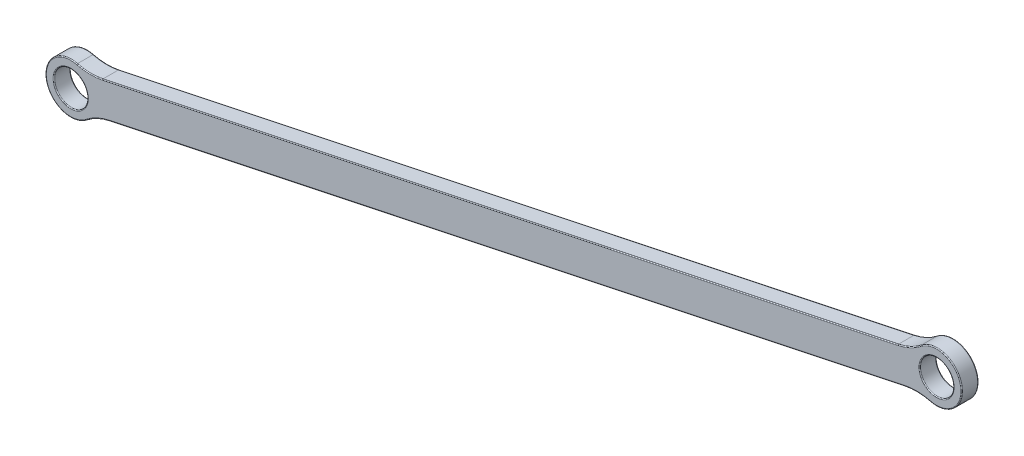
from build123d import *

# Parameters (mm, degrees)
BOSS_EXTRUDE1_DEPTH = 3
FILLET1_R           = 10
FILLET2_R           = 0.15


with BuildPart() as part:
    # Sketch1 → Boss-Extrude1 (new body)
    with BuildSketch(Plane.XY):
        with BuildLine():
            ThreePointArc((-209.835147147, 194.207413795), (-213.390440211, 196.522557684), (-211.075296322, 200.077850749))
            Line((-211.075296322, 200.077850749), (-207.793622301, 200.771115213))
            ThreePointArc((-207.793622301, 200.771115213), (-214.85804945, 196.212520391), (-206.553473126, 194.90067826))
            Line((-206.553473126, 194.90067826), (-209.835147147, 194.207413795))
        make_face()
        with BuildLine():
            Line((-207.793622301, 200.771115213), (-211.075296322, 200.077850749))
            ThreePointArc((-211.075296322, 200.077850749), (-207.520003258, 197.762706859), (-209.835147147, 194.207413795))
            Line((-209.835147147, 194.207413795), (-206.553473126, 194.90067826))
            ThreePointArc((-206.553473126, 194.90067826), (-206.107356239, 195.982431587), (-205.955221735, 197.142632272))
            ThreePointArc((-205.955221735, 197.142632272), (-206.441047009, 199.176446736), (-207.793622301, 200.771115213))
        make_face()
        with BuildLine():
            Line((-59.594334041, 232.07870382), (-207.793622301, 200.771115213))
            ThreePointArc((-207.793622301, 200.771115213), (-206.441047009, 199.176446736), (-205.955221735, 197.142632272))
            ThreePointArc((-205.955221735, 197.142632272), (-206.107356239, 195.982431587), (-206.553473126, 194.90067826))
            Line((-206.553473126, 194.90067826), (-58.354184866, 226.208266866))
            ThreePointArc((-58.354184866, 226.208266866), (-60.095413147, 228.906637926), (-59.594334041, 232.07870382))
        make_face()
        with BuildLine():
            ThreePointArc((-51.192585432, 229.836749808), (-54.532384747, 234.184615303), (-59.594334041, 232.07870382))
            Line((-59.594334041, 232.07870382), (-56.31266002, 232.771968284))
            ThreePointArc((-56.31266002, 232.771968284), (-52.757366956, 230.456824395), (-55.072510845, 226.901531331))
            Line((-55.072510845, 226.901531331), (-58.354184866, 226.208266866))
            ThreePointArc((-58.354184866, 226.208266866), (-53.658770968, 225.822575082), (-51.192585432, 229.836749808))
        make_face()
        with BuildLine():
            Line((-56.31266002, 232.771968284), (-59.594334041, 232.07870382))
            ThreePointArc((-59.594334041, 232.07870382), (-60.095413147, 228.906637926), (-58.354184866, 226.208266866))
            Line((-58.354184866, 226.208266866), (-55.072510845, 226.901531331))
            ThreePointArc((-55.072510845, 226.901531331), (-58.627803909, 229.21667522), (-56.31266002, 232.771968284))
        make_face()
    extrude(amount=-BOSS_EXTRUDE1_DEPTH)

    # Fillet1
    fillet1_edges = [part.edges().sort_by_distance(p)[0] for p in [
        (-207.793622301, 200.771115213, -1.5),
        (-59.594334041, 232.07870382, -1.5),
        (-58.354184866, 226.208266866, -1.5),
        (-206.553473126, 194.90067826, -1.5),
    ]]
    fillet(fillet1_edges, radius=FILLET1_R)

    # Fillet2
    fillet2_edges = [part.edges().sort_by_distance(p)[0] for p in [
        (-56.31266002, 232.771968284, 0),
        (-51.289757717, 230.766861689, 0),
        (-51.289757717, 230.766861689, -3),
        (-133.693978171, 216.424909516, 0),
        (-133.693978171, 216.424909516, -3),
        (-132.453828996, 210.554472563, 0),
        (-132.453828996, 210.554472563, -3),
        (-209.835147147, 194.207413795, -3),
        (-214.85804945, 196.212520391, 0),
        (-214.85804945, 196.212520391, -3),
        (-60.425568376, 232.170940787, 0),
        (-60.425568376, 232.170940787, -3),
        (-59.077090387, 225.787712727, 0),
        (-59.077090387, 225.787712727, -3),
        (-205.722238791, 194.808441292, 0),
        (-205.722238791, 194.808441292, -3),
        (-207.07071678, 201.191669353, 0),
        (-207.07071678, 201.191669353, -3),
        (-56.31266002, 232.771968284, -3),
        (-209.835147147, 194.207413795, 0),
    ]]
    fillet(fillet2_edges, radius=FILLET2_R)


solid = part.part
